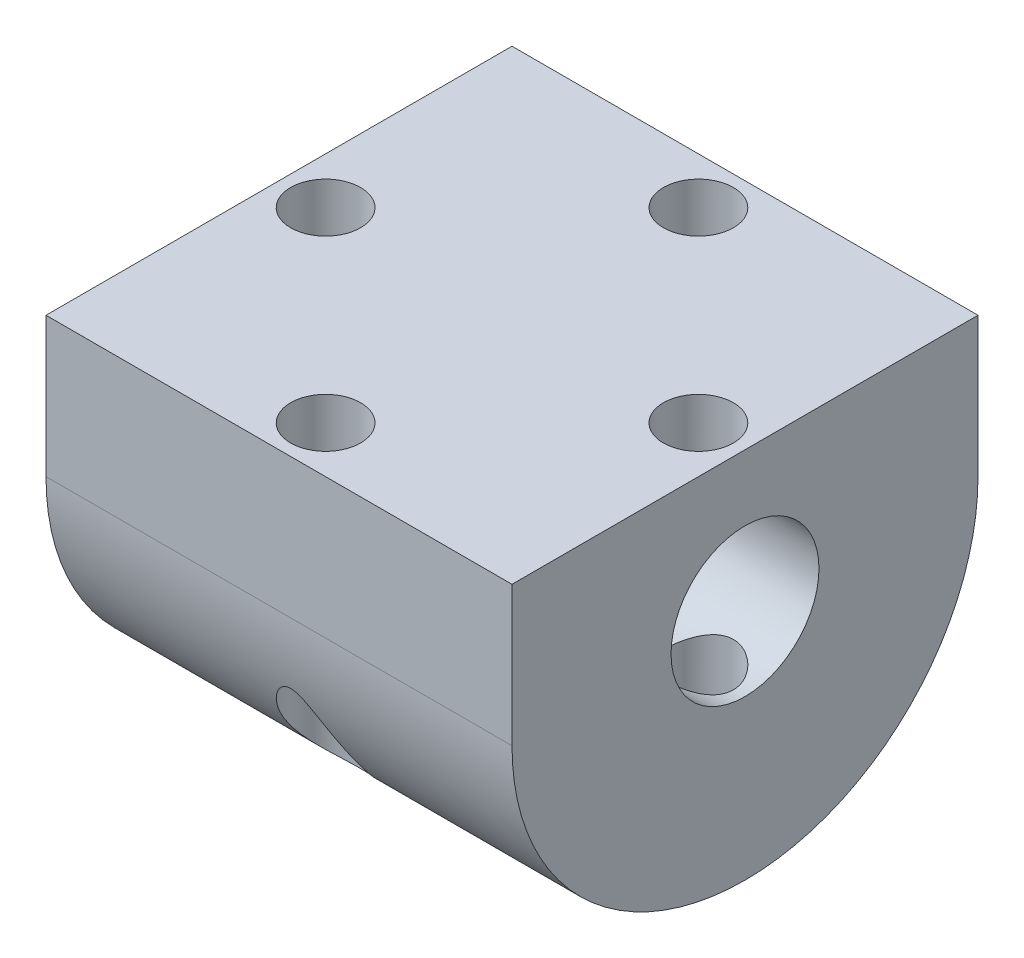
from build123d import *

# Parameters (mm, degrees)
SKETCH1_W               = 20
SKETCH1_H               = 20
SKETCH1_R               = 1.5
SKETCH1_R_2             = 8
BOSS_EXTRUDE1_DEPTH     = 2.5
SKETCH2_R               = 3.175
BOSS_EXTRUDE2_DEPTH     = 20
CUT_EXTRUDE2_DEPTH      = 27.119915773
CUT_EXTRUDE2_DEPTH_BACK = 27.119915773
SKETCH1_3_R             = 1.5


with BuildPart() as part:
    # Sketch1 → Boss-Extrude1 (new body)
    # profile 1 of 18: a face of its own
    with BuildSketch(Plane(origin=(0, 0, 0), x_dir=(1, 0, 0), z_dir=(0, 1, 0))):
        with Locations((0, -10)):
            Rectangle(SKETCH1_W, SKETCH1_H)
        with Locations((0, -2)):
            Circle(SKETCH1_R, mode=Mode.SUBTRACT)
        with Locations((0, -10)):
            Circle(SKETCH1_R_2, mode=Mode.SUBTRACT)
        with Locations((8, -10)):
            Circle(SKETCH1_R, mode=Mode.SUBTRACT)
        with Locations((0, -18)):
            Circle(SKETCH1_R, mode=Mode.SUBTRACT)
        with Locations((-8, -10)):
            Circle(SKETCH1_R, mode=Mode.SUBTRACT)
    # profile 2 of 18: a face of its own
    with BuildSketch(Plane(origin=(0, 0, 0), x_dir=(1, 0, 0), z_dir=(0, 1, 0))):
        with Locations((8, -10)):
            Circle(SKETCH1_R)
    # profile 3 of 18: a face of its own
    with BuildSketch(Plane(origin=(0, 0, 0), x_dir=(1, 0, 0), z_dir=(0, 1, 0))):
        with Locations((0, -18)):
            Circle(SKETCH1_R)
    # profile 4 of 18: a face of its own
    with BuildSketch(Plane(origin=(0, 0, 0), x_dir=(1, 0, 0), z_dir=(0, 1, 0))):
        with Locations((-8, -10)):
            Circle(SKETCH1_R)
    # profile 5 of 18: a face of its own
    with BuildSketch(Plane(origin=(0, 0, 0), x_dir=(1, 0, 0), z_dir=(0, 1, 0))):
        with Locations((0, -10)):
            Circle(SKETCH1_R_2)
    # profile 6 of 18: a face of its own
    with BuildSketch(Plane(origin=(0, 0, 0), x_dir=(1, 0, 0), z_dir=(0, 1, 0))):
        with Locations((0, -2)):
            Circle(SKETCH1_R)
    # profile 7 of 18: a face of its own
    with BuildSketch(Plane(origin=(0, 0, 0), x_dir=(1, 0, 0), z_dir=(0, 1, 0))):
        with Locations((0, -10)):
            Circle(SKETCH1_R_2)
    # profile 8 of 18: a face of its own
    with BuildSketch(Plane(origin=(0, 0, 0), x_dir=(1, 0, 0), z_dir=(0, 1, 0))):
        with Locations((8, -10)):
            Circle(SKETCH1_R)
    # profile 9 of 18: a face of its own
    with BuildSketch(Plane(origin=(0, 0, 0), x_dir=(1, 0, 0), z_dir=(0, 1, 0))):
        with Locations((0, -10)):
            Circle(SKETCH1_R_2)
    # profile 10 of 18: a face of its own
    with BuildSketch(Plane(origin=(0, 0, 0), x_dir=(1, 0, 0), z_dir=(0, 1, 0))):
        with Locations((0, -18)):
            Circle(SKETCH1_R)
    # profile 11 of 18: a face of its own
    with BuildSketch(Plane(origin=(0, 0, 0), x_dir=(1, 0, 0), z_dir=(0, 1, 0))):
        with Locations((0, -10)):
            Circle(SKETCH1_R_2)
    # profile 12 of 18: a face of its own
    with BuildSketch(Plane(origin=(0, 0, 0), x_dir=(1, 0, 0), z_dir=(0, 1, 0))):
        with Locations((0, -18)):
            Circle(SKETCH1_R)
    # profile 13 of 18: a face of its own
    with BuildSketch(Plane(origin=(0, 0, 0), x_dir=(1, 0, 0), z_dir=(0, 1, 0))):
        with Locations((0, -10)):
            Circle(SKETCH1_R_2)
    # profile 14 of 18: a face of its own
    with BuildSketch(Plane(origin=(0, 0, 0), x_dir=(1, 0, 0), z_dir=(0, 1, 0))):
        with Locations((-8, -10)):
            Circle(SKETCH1_R)
    # profile 15 of 18: a face of its own
    with BuildSketch(Plane(origin=(0, 0, 0), x_dir=(1, 0, 0), z_dir=(0, 1, 0))):
        with Locations((0, -10)):
            Circle(SKETCH1_R_2)
    # profile 16 of 18: a face of its own
    with BuildSketch(Plane(origin=(0, 0, 0), x_dir=(1, 0, 0), z_dir=(0, 1, 0))):
        with Locations((-8, -10)):
            Circle(SKETCH1_R)
    # profile 17 of 18: a face of its own
    with BuildSketch(Plane(origin=(0, 0, 0), x_dir=(1, 0, 0), z_dir=(0, 1, 0))):
        with Locations((0, -10)):
            Circle(SKETCH1_R_2)
    # profile 18 of 18: a face of its own
    with BuildSketch(Plane(origin=(0, 0, 0), x_dir=(1, 0, 0), z_dir=(0, 1, 0))):
        with Locations((8, -10)):
            Circle(SKETCH1_R)
    extrude(amount=BOSS_EXTRUDE1_DEPTH)

    # Sketch2 → Boss-Extrude2 (add)
    with BuildSketch(Plane.ZY.offset(10)):
        with BuildLine():
            Line((0, 0), (20, 0))
            Line((20, 0), (20, -3.5))
            ThreePointArc((20, -3.5), (10, -13.5), (0, -3.5))
            Line((0, -3.5), (0, 0))
        make_face()
        with Locations((10, -3.5)):
            Circle(SKETCH2_R, mode=Mode.SUBTRACT)
    extrude(amount=-BOSS_EXTRUDE2_DEPTH)

    # Sketch1<3> → Cut-Extrude2 (cut, two sides: drawn at the far end of the back side and taken through both)
    with BuildSketch(Plane(origin=(0, 0, 0), x_dir=(1, 0, 0), z_dir=(0, 1, 0)).offset(-CUT_EXTRUDE2_DEPTH_BACK)):
        with Locations(Location((8, -10, 0), (0, 0, 270))):
            Circle(SKETCH1_3_R)
        with Locations(Location((0, -18, 0), (0, 0, 270))):
            Circle(SKETCH1_3_R)
        with Locations(Location((-8, -10, 0), (0, 0, 270))):
            Circle(SKETCH1_3_R)
        with Locations(Location((0, -2, 0), (0, 0, 270))):
            Circle(SKETCH1_3_R)
    extrude(amount=CUT_EXTRUDE2_DEPTH + CUT_EXTRUDE2_DEPTH_BACK, mode=Mode.SUBTRACT)


solid = part.part
